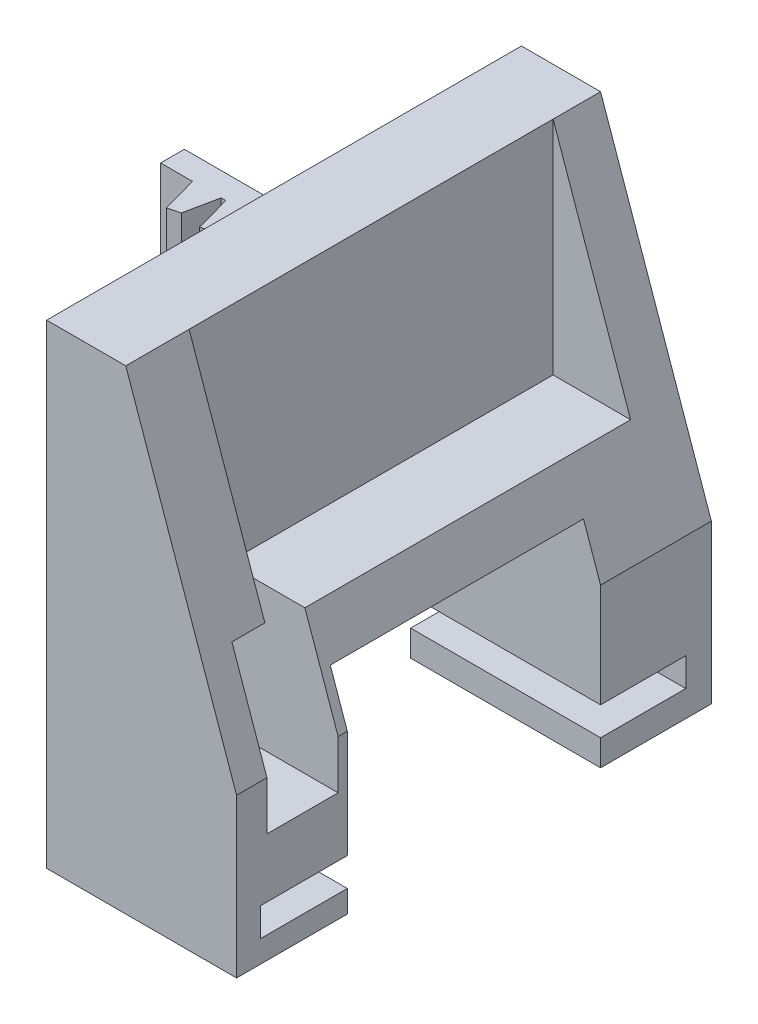
from build123d import *

# Parameters (mm, degrees)
BOSS_EXTRUDE1_DEPTH = 30
SKETCH4_W           = 16
SKETCH4_H           = 14
CUT_EXTRUDE2_DEPTH  = 25
SKETCH5_W           = 5.5
SKETCH5_H           = 1.8
CUT_EXTRUDE3_DEPTH  = 15
CUT_EXTRUDE4_DEPTH  = 11.5
BOSS_EXTRUDE2_DEPTH = 8
SKETCH8_W           = 4.5
SKETCH8_H           = 9.4
CUT_EXTRUDE5_DEPTH  = 47.486557197
SKETCH9_W           = 5.5
SKETCH9_H           = 1.8
CUT_EXTRUDE6_DEPTH  = 47.486557197


with BuildPart() as part:
    # Sketch1 → Boss-Extrude1 (new body)
    with BuildSketch(Plane.XY):
        Polygon((0, 0), (0, -30), (12, -30), (12, -20), (5, 0), align=None)
    extrude(amount=-BOSS_EXTRUDE1_DEPTH)

    # Sketch4 → Cut-Extrude2 (cut)
    with BuildSketch(Plane.ZY):
        with Locations((-15, -23.917856259)):
            Rectangle(SKETCH4_W, SKETCH4_H)
    extrude(amount=-CUT_EXTRUDE2_DEPTH, mode=Mode.SUBTRACT)

    # Sketch5 → Cut-Extrude3 (cut)
    with BuildSketch(Plane.ZY):
        with Locations((-4.25, -27.7)):
            Rectangle(SKETCH5_W, SKETCH5_H)
    extrude(amount=-CUT_EXTRUDE3_DEPTH, mode=Mode.SUBTRACT)

    # Sketch6 → Cut-Extrude4 (cut, symmetric)
    with BuildSketch(Plane.XY.offset(-15.5)):
        Polygon((5, 0), (5, -14), (9.9, -14), align=None)
    extrude(amount=CUT_EXTRUDE4_DEPTH, both=True, mode=Mode.SUBTRACT)

    # Sketch7 → Boss-Extrude2 (add)
    with BuildSketch(Plane(origin=(0, -22, 0), x_dir=(1, 0, 0), z_dir=(0, 1, 0))):
        with BuildLine():
            Line((0, 27.7), (-19, 27.7))
            Line((-19, 27.7), (-19, 26.2))
            Line((-19, 26.2), (-16.993455994, 26.2))
            ThreePointArc((-16.993455994, 26.2), (-16.6644108, 25.067952934), (-16.365476207, 23.927584833))
            Line((-16.365476207, 23.927584833), (-15.609396851, 24.115112691))
            Line((-15.609396851, 24.115112691), (-15.179008189, 26.2))
            Line((-15.179008189, 26.2), (-14.896454824, 26.2))
            ThreePointArc((-14.896454824, 26.2), (-14.56740963, 25.067952934), (-14.268475038, 23.927584833))
            Line((-14.268475038, 23.927584833), (-13.512395681, 24.115112691))
            Line((-13.512395681, 24.115112691), (-13.082007019, 26.2))
            Line((-13.082007019, 26.2), (-12.799453654, 26.2))
            ThreePointArc((-12.799453654, 26.2), (-12.470408461, 25.067952934), (-12.171473868, 23.927584833))
            Line((-12.171473868, 23.927584833), (-11.415394512, 24.115112691))
            Line((-11.415394512, 24.115112691), (-10.985005849, 26.2))
            Line((-10.985005849, 26.2), (-10.702452484, 26.2))
            ThreePointArc((-10.702452484, 26.2), (-10.373407291, 25.067952934), (-10.074472698, 23.927584833))
            Line((-10.074472698, 23.927584833), (-9.318393342, 24.115112691))
            Line((-9.318393342, 24.115112691), (-8.888004679, 26.2))
            Line((-8.888004679, 26.2), (-8.605451315, 26.2))
            ThreePointArc((-8.605451315, 26.2), (-8.276406121, 25.067952934), (-7.977471528, 23.927584833))
            Line((-7.977471528, 23.927584833), (-7.221392172, 24.115112691))
            Line((-7.221392172, 24.115112691), (-6.791003509, 26.2))
            Line((-6.791003509, 26.2), (-6.508450145, 26.2))
            ThreePointArc((-6.508450145, 26.2), (-6.179404951, 25.067952934), (-5.880470358, 23.927584833))
            Line((-5.880470358, 23.927584833), (-5.124391002, 24.115112691))
            Line((-5.124391002, 24.115112691), (-4.69400234, 26.2))
            Line((-4.69400234, 26.2), (-4.411448975, 26.2))
            ThreePointArc((-4.411448975, 26.2), (-4.082403781, 25.067952934), (-3.783469189, 23.927584833))
            Line((-3.783469189, 23.927584833), (-3.027389832, 24.115112691))
            Line((-3.027389832, 24.115112691), (-2.59700117, 26.2))
            Line((-2.59700117, 26.2), (-2.314447805, 26.2))
            ThreePointArc((-2.314447805, 26.2), (-1.985402612, 25.067952934), (-1.686468019, 23.927584833))
            Line((-1.686468019, 23.927584833), (-0.930388662, 24.115112691))
            Line((-0.930388662, 24.115112691), (-0.5, 26.2))
            Line((-0.5, 26.2), (0, 26.2))
            Line((0, 26.2), (0, 27.7))
        make_face()
    extrude(amount=BOSS_EXTRUDE2_DEPTH)

    # Sketch8 → Cut-Extrude5 (cut, through all)
    with BuildSketch(Plane.ZY):
        with Locations((-4.168450475, -18.374722701)):
            Rectangle(SKETCH8_W, SKETCH8_H)
    extrude(amount=-CUT_EXTRUDE5_DEPTH, mode=Mode.SUBTRACT)

    # Sketch9 → Cut-Extrude6 (cut, through all)
    with BuildSketch(Plane.ZY):
        with Locations((-25.635290025, -27.453702253)):
            Rectangle(SKETCH9_W, SKETCH9_H)
    extrude(amount=-CUT_EXTRUDE6_DEPTH, mode=Mode.SUBTRACT)


solid = part.part
